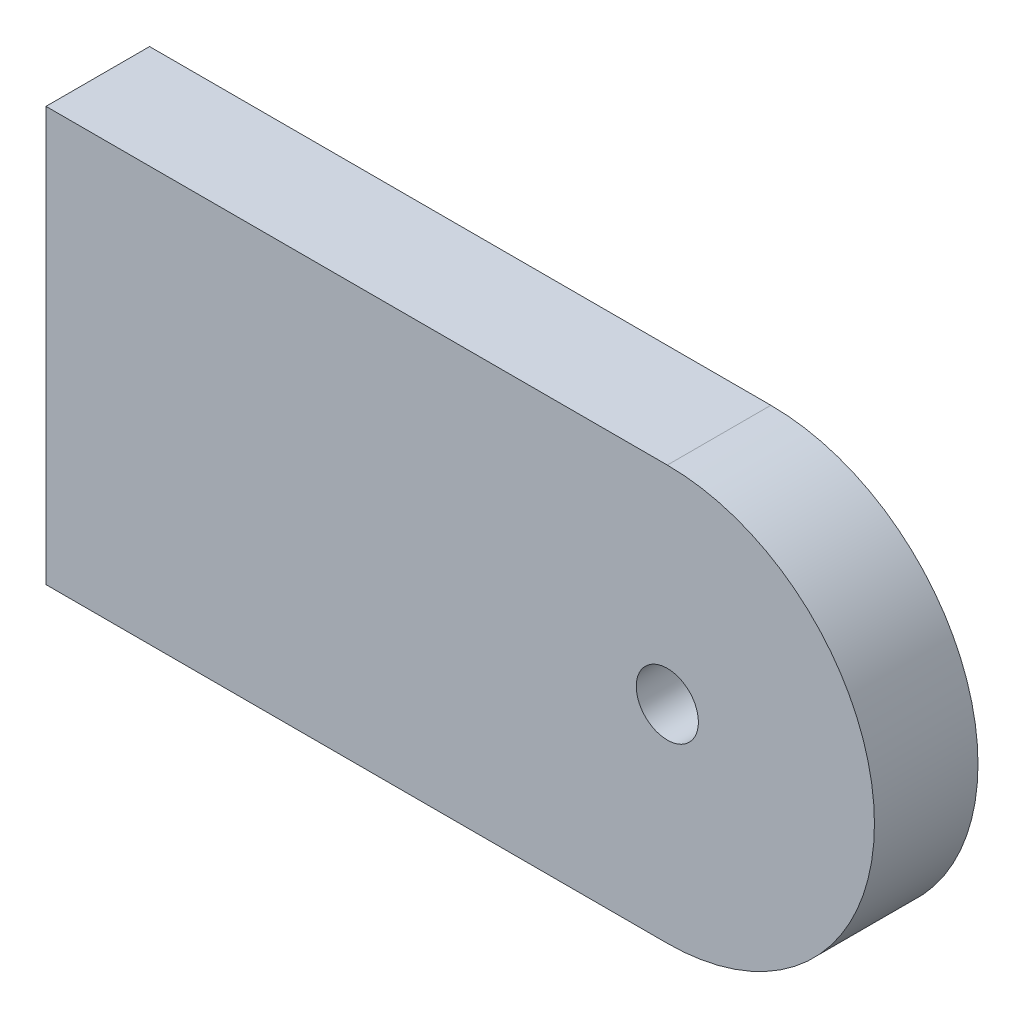
from build123d import *

# Parameters (mm, degrees)
SKETCH1_R           = 1.5
BOSS_EXTRUDE1_DEPTH = 5


with BuildPart() as part:
    # Sketch1 → Boss-Extrude1 (new body)
    with BuildSketch(Plane.XY):
        with BuildLine():
            Line((-20, 10), (10, 10))
            ThreePointArc((10, 10), (20, 0), (10, -10))
            Line((10, -10), (-20, -10))
            Line((-20, -10), (-20, 10))
        make_face()
        with Locations((10, 0)):
            Circle(SKETCH1_R, mode=Mode.SUBTRACT)
    extrude(amount=BOSS_EXTRUDE1_DEPTH)


solid = part.part
